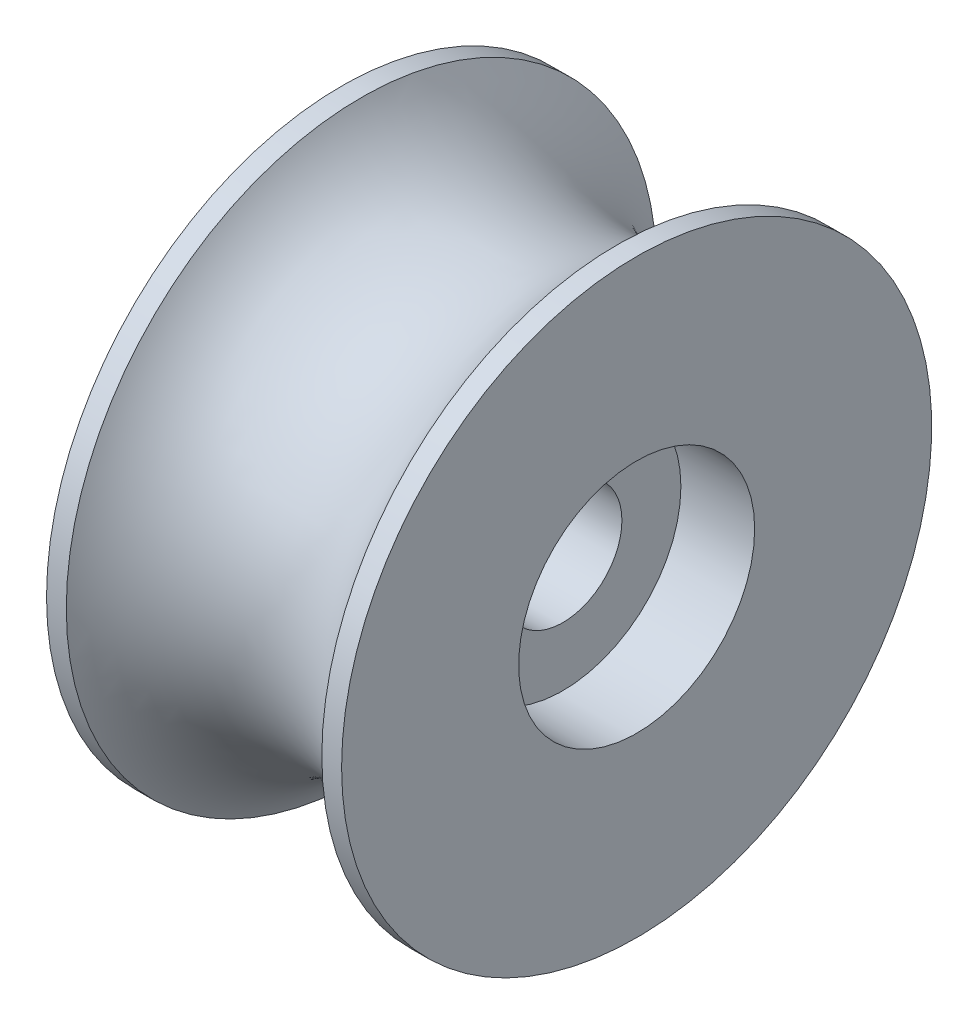
from build123d import *

# Parameters (mm, degrees)
SKETCH_2_R          = 4
CUT_EXTRUDE_1_DEPTH = 55
SKETCH_3_R          = 8
CUT_EXTRUDE_2_DEPTH = 5
CUT_EXTRUDE_START   = -5
SKETCH_4_R          = 8
CUT_EXTRUDE_3_DEPTH = 5


with BuildPart() as part:
    # 草图1 → 旋转1 (revolve)
    with BuildSketch(Plane(origin=(0, 0, 0), x_dir=(1, 0, 0), z_dir=(0, 1, 0)), mode=Mode.PRIVATE) as revolve_1_sk:
        with BuildLine():
            Line((-10, 10), (-10, -10))
            Line((-10, -10), (10, -10))
            Line((10, -10), (10, 10))
            Line((10, 10), (8.660254038, 10))
            ThreePointArc((8.660254038, 10), (0, 5), (-8.660254038, 10))
            Line((-8.660254038, 10), (-10, 10))
        make_face()
    revolve(revolve_1_sk.sketch.rotate(Axis((-10, 0, 10), (1, 0, 0)), 180), axis=Axis((-10, 0, 10), (1, 0, 0)))

    # 草图2 → 切除-拉伸1 (cut)
    with BuildSketch(Plane(origin=(10, 0, 0), x_dir=(0, 0, -1), z_dir=(1, 0, 0))):
        with Locations((-10, 0)):
            Circle(SKETCH_2_R)
    extrude(amount=-CUT_EXTRUDE_1_DEPTH, mode=Mode.SUBTRACT)

    # 草图3 → 切除-拉伸2 (cut)
    with BuildSketch(Plane(origin=(10, 0, 0), x_dir=(0, 0, -1), z_dir=(1, 0, 0))):
        with Locations((-10, 0)):
            Circle(SKETCH_3_R)
    extrude(amount=-CUT_EXTRUDE_2_DEPTH, mode=Mode.SUBTRACT)

    # 草图4 → 切除-拉伸3 (cut)
    with BuildSketch(Plane.ZY.offset(10).offset(CUT_EXTRUDE_START)):
        with Locations(Location((10, 0, 0), (0, 0, 180))):
            Circle(SKETCH_4_R)
    extrude(amount=CUT_EXTRUDE_3_DEPTH, mode=Mode.SUBTRACT)


solid = part.part
